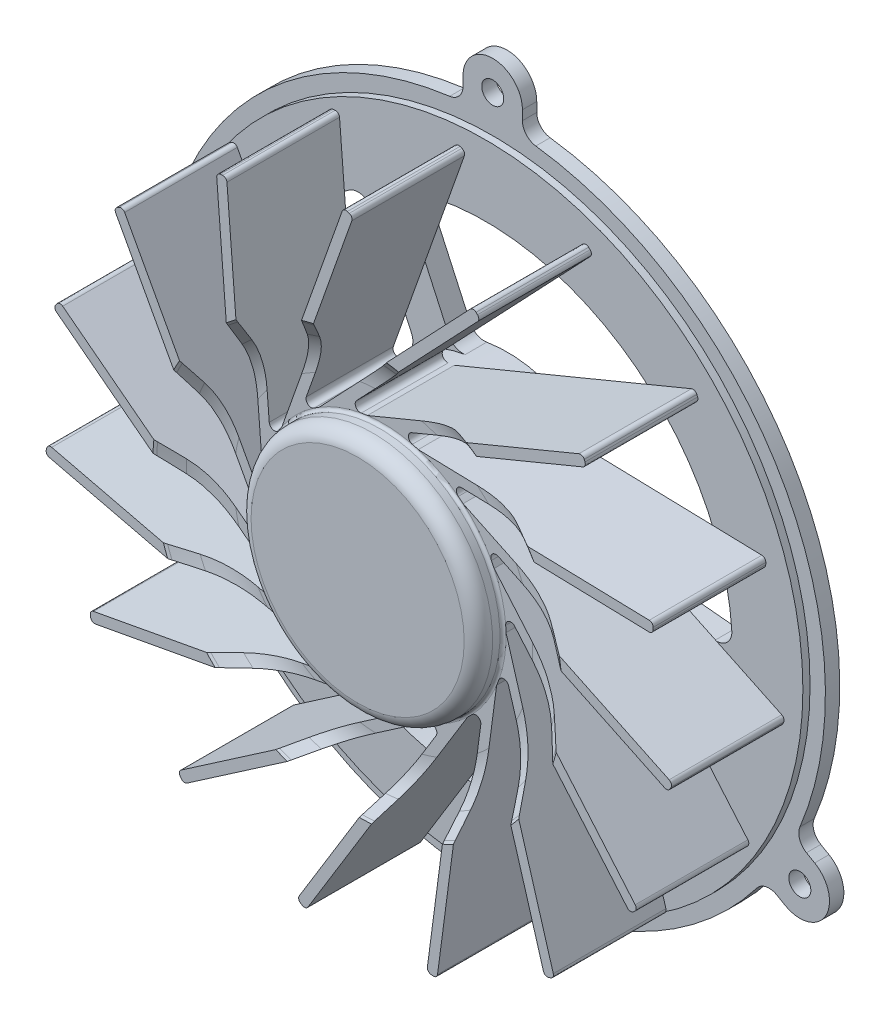
from build123d import *

# Parameters (mm, degrees)
SKETCH1_R              = 1.075
EXTRUDE_BOTTOM_DEPTH   = 1.4
SKETCH1_3_R            = 31
EXTRUDE_OFFSET_DEPTH   = 2.1
SKETCH2_R              = 12
EXTRUDE_FAN_BASE_DEPTH = 1.5
BOSS_EXTRUDE4_DEPTH    = 11


with BuildPart() as part:
    # Sketch1 → extrude-bottom (new body)
    with BuildSketch(Plane.XY):
        with BuildLine():
            ThreePointArc((2.9, 34.641016151), (0, 37.541016151), (-2.9, 34.641016151))
            Line((-2.9, 34.641016151), (-2.9, 33.714092009))
            ThreePointArc((-2.9, 33.714092009), (-3.272796276, 32.724439664), (-4.205882353, 32.226705597))
            ThreePointArc((-4.205882353, 32.226705597), (-28.145825623, 16.25), (-30.012086904, -12.470951835))
            ThreePointArc((-30.012086904, -12.470951835), (-29.976594211, -13.527895115), (-30.647260145, -14.345572334))
            Line((-30.647260145, -14.345572334), (-31.45, -14.809034405))
            ThreePointArc((-31.45, -14.809034405), (-32.511473671, -18.770508076), (-28.55, -19.831981747))
            Line((-28.55, -19.831981747), (-27.747260145, -19.368519676))
            ThreePointArc((-27.747260145, -19.368519676), (-26.703797935, -19.196544548), (-25.806204551, -19.755753761))
            ThreePointArc((-25.806204551, -19.755753761), (0, -32.5), (25.806204551, -19.755753761))
            ThreePointArc((25.806204551, -19.755753761), (26.703797935, -19.196544548), (27.747260145, -19.368519676))
            Line((27.747260145, -19.368519676), (28.55, -19.831981747))
            ThreePointArc((28.55, -19.831981747), (32.511473671, -18.770508076), (31.45, -14.809034405))
            Line((31.45, -14.809034405), (30.647260145, -14.345572334))
            ThreePointArc((30.647260145, -14.345572334), (29.976594211, -13.527895115), (30.012086904, -12.470951836))
            ThreePointArc((30.012086904, -12.470951836), (28.145825623, 16.25), (4.205882353, 32.226705597))
            ThreePointArc((4.205882353, 32.226705597), (3.272796276, 32.724439664), (2.9, 33.714092009))
            Line((2.9, 33.714092009), (2.9, 34.641016151))
        make_face()
        with Locations((-30, -17.320508076)):
            Circle(SKETCH1_R, mode=Mode.SUBTRACT)
        with Locations((30, -17.320508076)):
            Circle(SKETCH1_R, mode=Mode.SUBTRACT)
        with Locations((0, 34.641016151)):
            Circle(SKETCH1_R, mode=Mode.SUBTRACT)
        with BuildLine():
            Line((22.416359615, -0.129698178), (13.169420743, 0.752567134))
            ThreePointArc((13.169420743, 0.752567134), (12.290098032, 1.147633402), (11.832792128, 1.996254104))
            ThreePointArc((11.832792128, 1.996254104), (6.959938826, 9.775441245), (-1.985467188, 11.834606882))
            ThreePointArc((-1.985467188, 11.834606882), (-2.937008081, 11.98905983), (-3.598051143, 12.690706362))
            Line((-3.598051143, 12.690706362), (-7.457456406, 21.139922988))
            ThreePointArc((-7.457456406, 21.139922988), (-7.453569696, 22.394815476), (-6.497462211, 23.207606185))
            ThreePointArc((-6.497462211, 23.207606185), (13.977877143, 19.6323445), (24.056097495, 1.454019707))
            ThreePointArc((24.056097495, 1.454019707), (23.600899767, 0.284590236), (22.416359615, -0.129698178))
        make_face(mode=Mode.SUBTRACT)
        with BuildLine():
            ThreePointArc((-13.287266752, 20.106181693), (-12.046912257, 20.296683632), (-11.095857891, 19.477985976))
            Line((-11.095857891, 19.477985976), (-7.236452628, 11.028769349))
            ThreePointArc((-7.236452628, 11.028769349), (-7.138928697, 10.06972041), (-7.645202831, 9.249371529))
            ThreePointArc((-7.645202831, 9.249371529), (-11.945749865, 1.13976321), (-9.25633661, -7.636768464))
            ThreePointArc((-9.25633661, -7.636768464), (-8.914326339, -8.538053525), (-9.19144853, -9.461356875))
            Line((-9.19144853, -9.461356875), (-14.578982139, -17.028308189))
            ThreePointArc((-14.578982139, -17.028308189), (-15.667694267, -17.652388444), (-16.849645412, -17.230770427))
            ThreePointArc((-16.849645412, -17.230770427), (-23.991047645, 2.289024446), (-13.287266752, 20.106181693))
        make_face(mode=Mode.SUBTRACT)
        with BuildLine():
            ThreePointArc((11.241803797, -4.197838418), (11.851334421, -3.451006305), (12.789499673, -3.229349487))
            Line((12.789499673, -3.229349487), (22.036438545, -4.111614799))
            ThreePointArc((22.036438545, -4.111614799), (23.121263963, -4.742427032), (23.347107622, -5.976835758))
            ThreePointArc((23.347107622, -5.976835758), (10.013170502, -21.921368947), (-10.768830743, -21.5602014))
            ThreePointArc((-10.768830743, -21.5602014), (-11.553987509, -20.581273868), (-11.320501724, -19.348287798))
            Line((-11.320501724, -19.348287798), (-5.932968115, -11.781336484))
            ThreePointArc((-5.932968115, -11.781336484), (-5.151169336, -11.217353812), (-4.187589297, -11.245625633))
            ThreePointArc((-4.187589297, -11.245625633), (4.985811038, -10.915204455), (11.241803797, -4.197838418))
        make_face(mode=Mode.SUBTRACT)
    extrude(amount=EXTRUDE_BOTTOM_DEPTH)

    # Sketch1<3> → extrude-offset (add)
    with BuildSketch(Plane.XY):
        Circle(SKETCH1_3_R)
        with BuildLine():
            ThreePointArc((-13.287266752, 20.106181693), (-12.046912257, 20.296683632), (-11.095857891, 19.477985976))
            Line((-11.095857891, 19.477985976), (-7.236452628, 11.028769349))
            ThreePointArc((-7.236452628, 11.028769349), (-7.138928697, 10.06972041), (-7.645202831, 9.249371529))
            ThreePointArc((-7.645202831, 9.249371529), (-11.945749865, 1.13976321), (-9.25633661, -7.636768464))
            ThreePointArc((-9.25633661, -7.636768464), (-8.914326339, -8.538053525), (-9.19144853, -9.461356875))
            Line((-9.19144853, -9.461356875), (-14.578982139, -17.028308189))
            ThreePointArc((-14.578982139, -17.028308189), (-15.667694267, -17.652388444), (-16.849645412, -17.230770427))
            ThreePointArc((-16.849645412, -17.230770427), (-23.991047645, 2.289024446), (-13.287266752, 20.106181693))
        make_face(mode=Mode.SUBTRACT)
        with BuildLine():
            ThreePointArc((11.241803797, -4.197838418), (11.851334421, -3.451006305), (12.789499673, -3.229349487))
            Line((12.789499673, -3.229349487), (22.036438545, -4.111614799))
            ThreePointArc((22.036438545, -4.111614799), (23.121263963, -4.742427032), (23.347107622, -5.976835758))
            ThreePointArc((23.347107622, -5.976835758), (10.013170502, -21.921368947), (-10.768830743, -21.5602014))
            ThreePointArc((-10.768830743, -21.5602014), (-11.553987509, -20.581273868), (-11.320501724, -19.348287798))
            Line((-11.320501724, -19.348287798), (-5.932968115, -11.781336484))
            ThreePointArc((-5.932968115, -11.781336484), (-5.151169336, -11.217353812), (-4.187589297, -11.245625633))
            ThreePointArc((-4.187589297, -11.245625633), (4.985811038, -10.915204455), (11.241803797, -4.197838418))
        make_face(mode=Mode.SUBTRACT)
        with BuildLine():
            ThreePointArc((24.056097495, 1.454019707), (23.600899767, 0.284590236), (22.416359615, -0.129698178))
            Line((22.416359615, -0.129698178), (13.169420743, 0.752567134))
            ThreePointArc((13.169420743, 0.752567134), (12.290098032, 1.147633402), (11.832792128, 1.996254104))
            ThreePointArc((11.832792128, 1.996254104), (6.959938826, 9.775441245), (-1.985467188, 11.834606882))
            ThreePointArc((-1.985467188, 11.834606882), (-2.937008081, 11.98905983), (-3.598051143, 12.690706362))
            Line((-3.598051143, 12.690706362), (-7.457456406, 21.139922988))
            ThreePointArc((-7.457456406, 21.139922988), (-7.453569696, 22.394815476), (-6.497462211, 23.207606185))
            ThreePointArc((-6.497462211, 23.207606185), (13.977877143, 19.6323445), (24.056097495, 1.454019707))
        make_face(mode=Mode.SUBTRACT)
    extrude(amount=EXTRUDE_OFFSET_DEPTH)

    # Sketch2 → extrude-fan-base (add)
    with BuildSketch(Plane.XY.offset(2.1)):
        Circle(SKETCH2_R)
    extrude(amount=EXTRUDE_FAN_BASE_DEPTH)

    # Sketch3 → Boss-Extrude4 (add)
    with BuildSketch(Plane.XY.offset(3.6)):
        with BuildLine():
            Line((21.612215251, 21.49326877), (-1.548909516, 11.899616772))
            ThreePointArc((-1.548909516, 11.899616772), (-1.847492208, 11.856929305), (-2.144907723, 11.806751071))
            ThreePointArc((-2.144907723, 11.806751071), (-2.674110404, 12.060900318), (-2.596966064, 12.64287632))
            Line((-2.596966064, 12.64287632), (11.727015455, 27.73720336))
            ThreePointArc((11.727015455, 27.73720336), (11.836728637, 28.023015969), (11.712207537, 28.302694938))
            Line((11.712207537, 28.302694938), (11.567132663, 28.440365854))
            ThreePointArc((11.567132663, 28.440365854), (11.281320053, 28.550079035), (11.001641084, 28.425557935))
            Line((11.001641084, 28.425557935), (-6.255009433, 10.240842592))
            ThreePointArc((-6.255009433, 10.240842592), (-6.510415737, 10.080401129), (-6.761709004, 9.913591244))
            ThreePointArc((-6.761709004, 9.913591244), (-7.348531521, 9.930522011), (-7.514767625, 10.493560975))
            Line((-7.514767625, 10.493560975), (-0.568575282, 30.109003036))
            ThreePointArc((-0.568575282, 30.109003036), (-0.584597765, 30.414730219), (-0.812109135, 30.619582377))
            Line((-0.812109135, 30.619582377), (-1.000637433, 30.686343748))
            ThreePointArc((-1.000637433, 30.686343748), (-1.306364616, 30.670321266), (-1.511216773, 30.442809896))
            Line((-1.511216773, 30.442809896), (-9.879561393, 6.811333694))
            ThreePointArc((-9.879561393, 6.811333694), (-10.04762924, 6.560880021), (-10.20934937, 6.306281428))
            ThreePointArc((-10.20934937, 6.306281428), (-10.752324778, 6.083066233), (-11.133197594, 6.529813606))
            Line((-11.133197594, 6.529813606), (-12.765854188, 27.274682556))
            ThreePointArc((-12.765854188, 27.274682556), (-12.904841902, 27.547461304), (-13.19600476, 27.642065852))
            Line((-13.19600476, 27.642065852), (-13.395388226, 27.626374033))
            ThreePointArc((-13.395388226, 27.626374033), (-13.668166974, 27.487386318), (-13.762771522, 27.196223461))
            Line((-13.762771522, 27.196223461), (-11.795847435, 2.20408332))
            ThreePointArc((-11.795847435, 2.20408332), (-11.847516368, 1.906923153), (-11.89170048, 1.608558262))
            ThreePointArc((-11.89170048, 1.608558262), (-12.296943399, 1.18379304), (-12.826596557, 1.437002143))
            Line((-12.826596557, 1.437002143), (-22.75580093, 19.72432168))
            ThreePointArc((-22.75580093, 19.72432168), (-22.993721637, 19.91698607), (-23.298191279, 19.884985021))
            Line((-23.298191279, 19.884985021), (-23.473954702, 19.789553269))
            ThreePointArc((-23.473954702, 19.789553269), (-23.666619092, 19.551632561), (-23.634618043, 19.247162919))
            Line((-23.634618043, 19.247162919), (-11.672524294, -2.784273083))
            ThreePointArc((-11.672524294, -2.784273083), (-11.598860284, -3.076758052), (-11.517868545, -3.36729924))
            ThreePointArc((-11.517868545, -3.36729924), (-11.715308793, -3.920168723), (-12.302160449, -3.904280045))
            Line((-12.302160449, -3.904280045), (-28.811062962, 8.763446395))
            ThreePointArc((-28.811062962, 8.763446395), (-29.10677801, 8.842683003), (-29.37190887, 8.68960963))
            Line((-29.37190887, 8.68960963), (-29.493661155, 8.530938962))
            ThreePointArc((-29.493661155, 8.530938962), (-29.572897764, 8.235223914), (-29.419824391, 7.970093054))
            Line((-29.419824391, 7.970093054), (-9.530915661, -7.291203375))
            ThreePointArc((-9.530915661, -7.291203375), (-9.344655885, -7.528439838), (-9.152492502, -7.760920113))
            ThreePointArc((-9.152492502, -7.760920113), (-9.107990866, -8.346297701), (-9.650569039, -8.570476744))
            Line((-9.650569039, -8.570476744), (-29.884630467, -3.712708385))
            ThreePointArc((-29.884630467, -3.712708385), (-30.187008038, -3.760600288), (-30.366956581, -4.008278208))
            Line((-30.366956581, -4.008278208), (-30.413645653, -4.202752192))
            ThreePointArc((-30.413645653, -4.202752192), (-30.365753751, -4.505129763), (-30.118075831, -4.685078306))
            Line((-30.118075831, -4.685078306), (-5.741325125, -10.537418366))
            ThreePointArc((-5.741325125, -10.537418366), (-5.474675589, -10.678385982), (-5.204567358, -10.812607392))
            ThreePointArc((-5.204567358, -10.812607392), (-4.925818574, -11.329275983), (-5.330306568, -11.754760154))
            Line((-5.330306568, -11.754760154), (-25.790873871, -15.546902157))
            ThreePointArc((-25.790873871, -15.546902157), (-26.047630136, -15.713641625), (-26.111281624, -16.01309833))
            Line((-26.111281624, -16.01309833), (-26.074834519, -16.209749311))
            ThreePointArc((-26.074834519, -16.209749311), (-25.908095051, -16.466505577), (-25.608638346, -16.530157064))
            Line((-25.608638346, -16.530157064), (-0.959007316, -11.961617991))
            ThreePointArc((-0.959007316, -11.961617991), (-0.658074149, -11.98194218), (-0.356725235, -11.994696624))
            ThreePointArc((-0.356725235, -11.994696624), (0.108072498, -12.353319524), (-0.088385668, -12.906538745))
            Line((-0.088385668, -12.906538745), (-17.23764088, -24.692895306))
            ThreePointArc((-17.23764088, -24.692895306), (-17.404380348, -24.949651571), (-17.340728861, -25.249108276))
            Line((-17.340728861, -25.249108276), (-17.227447613, -25.413933514))
            ThreePointArc((-17.227447613, -25.413933514), (-16.970691348, -25.580672982), (-16.671234643, -25.517021495))
            Line((-16.671234643, -25.517021495), (3.98913157, -11.317545198))
            ThreePointArc((3.98913157, -11.317545198), (4.27231429, -11.213711723), (4.552797921, -11.102793841))
            ThreePointArc((4.552797921, -11.102793841), (5.123276854, -11.241361893), (5.168817917, -11.826659534))
            Line((5.168817917, -11.826659534), (-5.703863182, -29.569262529))
            ThreePointArc((-5.703863182, -29.569262529), (-5.751755084, -29.8716401), (-5.571806542, -30.119318021))
            Line((-5.571806542, -30.119318021), (-5.401278509, -30.223817733))
            ThreePointArc((-5.401278509, -30.223817733), (-5.098900938, -30.271709636), (-4.851223018, -30.091761094))
            Line((-4.851223018, -30.091761094), (8.247513368, -8.716566024))
            ThreePointArc((8.247513368, -8.716566024), (8.463980776, -8.506528635), (8.675100957, -8.291117138))
            ThreePointArc((8.675100957, -8.291117138), (9.252620098, -8.185670666), (9.532285927, -8.701843448))
            Line((9.532285927, -8.701843448), (6.816164278, -29.332835632))
            ThreePointArc((6.816164278, -29.332835632), (6.895400887, -29.628550681), (7.160531746, -29.781624054))
            Line((7.160531746, -29.781624054), (7.358820718, -29.807729292))
            ThreePointArc((7.358820718, -29.807729292), (7.654535767, -29.728492684), (7.80760914, -29.463361825))
            Line((7.80760914, -29.463361825), (11.079825178, -4.608413396))
            ThreePointArc((11.079825178, -4.608413396), (11.192148093, -4.328489467), (11.297400225, -4.045830959))
            ThreePointArc((11.297400225, -4.045830959), (11.78210127, -3.714602616), (12.247535102, -4.072399576))
            Line((12.247535102, -4.072399576), (18.157615012, -24.024494974))
            ThreePointArc((18.157615012, -24.024494974), (18.350279402, -24.262415682), (18.654749044, -24.294416731))
            Line((18.654749044, -24.294416731), (18.846512991, -24.237613662))
            ThreePointArc((18.846512991, -24.237613662), (19.084433698, -24.044949272), (19.116434747, -23.74047963))
            Line((19.116434747, -23.74047963), (11.996334557, 0.296575773))
            ThreePointArc((11.996334557, 0.296575773), (11.985091327, 0.597984853), (11.966276362, 0.899016149))
            ThreePointArc((11.966276362, 0.899016149), (12.274350095, 1.398753972), (12.845074193, 1.261199179))
            Line((12.845074193, 1.261199179), (26.359449153, -14.56210088))
            ThreePointArc((26.359449153, -14.56210088), (26.632227901, -14.701088594), (26.923390759, -14.606484047))
            Line((26.923390759, -14.606484047), (27.075471952, -14.476594437))
            ThreePointArc((27.075471952, -14.476594437), (27.214459666, -14.203815689), (27.119855119, -13.912652831))
            Line((27.119855119, -13.912652831), (10.838568709, 5.150284298))
            ThreePointArc((10.838568709, 5.150284298), (10.705703389, 5.42106216), (10.566074605, 5.688415196))
            ThreePointArc((10.566074605, 5.688415196), (10.64425228, 6.270253291), (11.221583262, 6.376725138))
            Line((11.221583262, 6.376725138), (30.003495068, -2.581787251))
            ThreePointArc((30.003495068, -2.581787251), (30.30922225, -2.597809733), (30.53673362, -2.392957576))
            Line((30.53673362, -2.392957576), (30.62283584, -2.212440519))
            ThreePointArc((30.62283584, -2.212440519), (30.638858323, -1.906713336), (30.434006165, -1.679201966))
            Line((30.434006165, -1.679201966), (7.806715865, 9.113461878))
            ThreePointArc((7.806715865, 9.113461878), (7.575202077, 9.30678857), (7.338902559, 9.494235579))
            ThreePointArc((7.338902559, 9.494235579), (7.173666545, 10.057568852), (7.65777864, 10.389657391))
            Line((7.65777864, 10.389657391), (28.459664112, 9.844940849))
            ThreePointArc((28.459664112, 9.844940849), (28.745476722, 9.954654031), (28.869997821, 10.234333))
            Line((28.869997821, 10.234333), (28.875233211, 10.434264465))
            ThreePointArc((28.875233211, 10.434264465), (28.76552003, 10.720077074), (28.48584106, 10.844598174))
            Line((28.48584106, 10.844598174), (3.425010927, 11.500839106))
            ThreePointArc((3.425010927, 11.500839106), (3.134879508, 11.583286687), (2.842767589, 11.658416378))
            ThreePointArc((2.842767589, 11.658416378), (2.462688695, 12.105839389), (2.769874522, 12.606123493))
            Line((2.769874522, 12.606123493), (21.994898683, 20.569389238))
            ThreePointArc((21.994898683, 20.569389238), (22.211377124, 20.785867678), (22.211377124, 21.092014424))
            Line((22.211377124, 21.092014424), (22.134840437, 21.27679033))
            ThreePointArc((22.134840437, 21.27679033), (21.918361997, 21.49326877), (21.612215251, 21.49326877))
        make_face()
    extrude(amount=BOSS_EXTRUDE4_DEPTH)

    # Sketch4 → Cut-Revolve5 (revolve, cut)
    with BuildSketch(Plane(origin=(0, 0, 0), x_dir=(1, 0, 0), z_dir=(0, 1, 0))):
        with BuildLine():
            Line((-20, -14.6), (-20, -15.6))
            Line((-20, -15.6), (-10, -15.6))
            Line((-10, -15.6), (-10, -14.6))
            ThreePointArc((-10, -14.6), (-11.190720869, -14.245044821), (-11.705323991, -13.114119097))
            Line((-11.705323991, -13.114119097), (-11.705323991, -12.4))
            ThreePointArc((-11.705323991, -12.4), (-11.793191957, -12.187867966), (-12.005323991, -12.1))
            Line((-12.005323991, -12.1), (-14.587960867, -12.1))
            ThreePointArc((-14.587960867, -12.1), (-16.434091663, -12.391077065), (-18.101100349, -13.236066306))
            Line((-18.101100349, -13.236066306), (-19.775873696, -14.445727608))
            ThreePointArc((-19.775873696, -14.445727608), (-19.887062238, -14.524134433), (-20, -14.6))
        make_face()
    revolve(axis=Axis((0, 0, 0), (0, 0, 1)), mode=Mode.SUBTRACT)


solid = part.part
